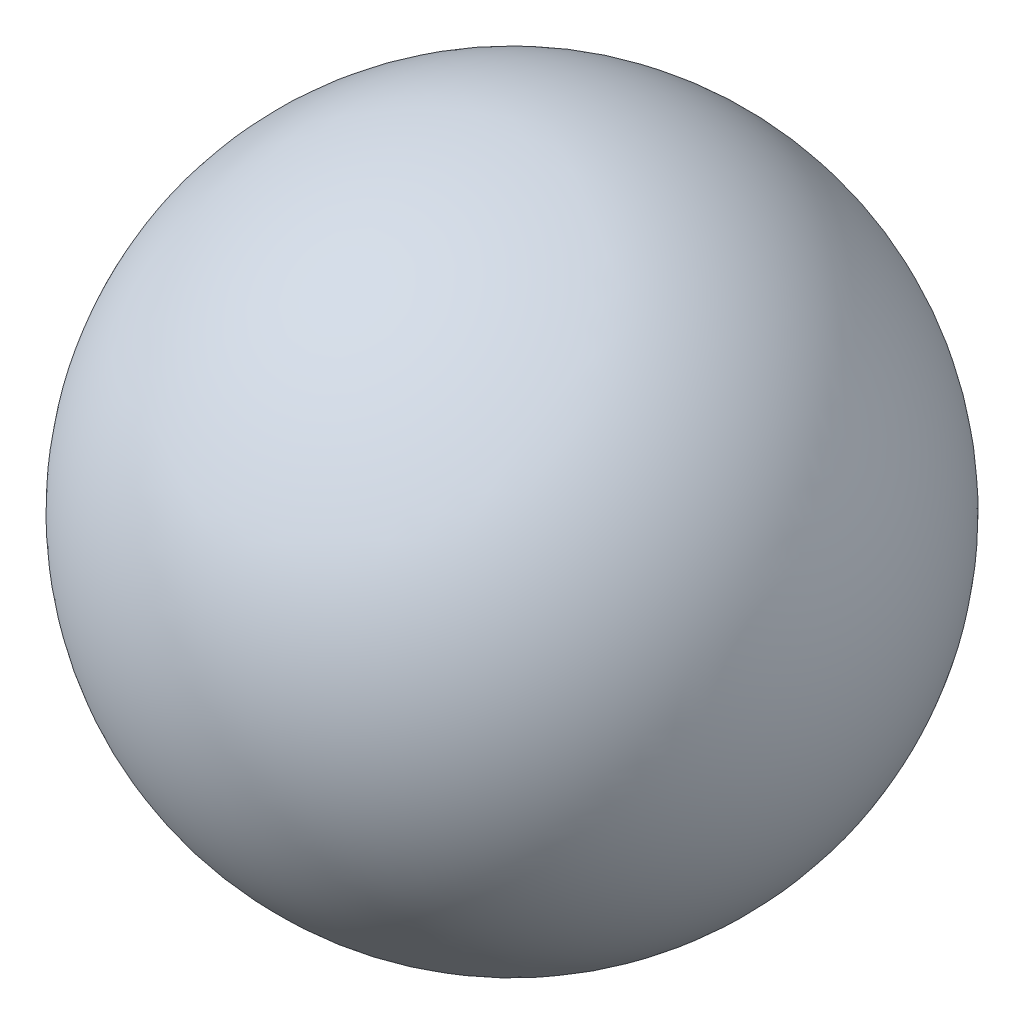
from build123d import *


with BuildPart() as part:
    # Sketch1 → Revolve1 (revolve)
    with BuildSketch(Plane(origin=(0, 0, 0), x_dir=(1, 0, 0), z_dir=(0, 1, 0))):
        with BuildLine():
            Line((-21, 0), (21, 0))
            ThreePointArc((21, 0), (0, 21), (-21, 0))
        make_face()
    revolve(axis=Axis((-21, 0, 0), (1, 0, 0)))


solid = part.part
